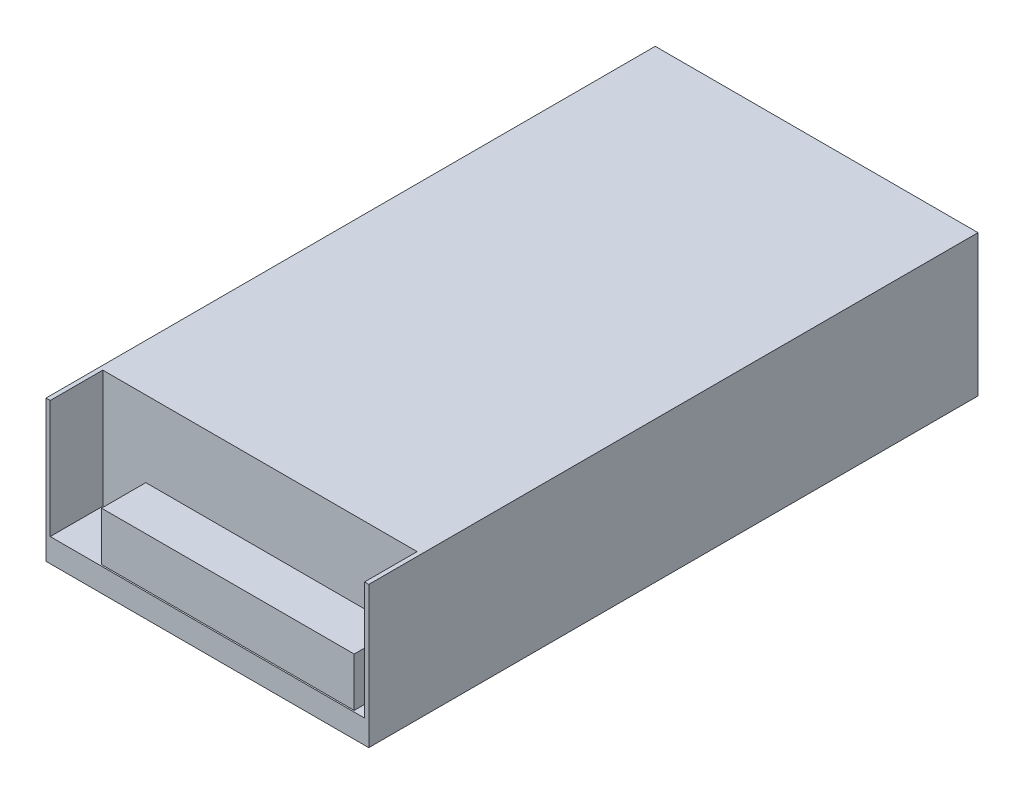
from build123d import *

# Parameters (mm, degrees)
SKETCH1_W           = 113.03
SKETCH1_H           = 213.36
BOSS_EXTRUDE1_DEPTH = 49.53
SKETCH2_W           = 110.0836
SKETCH2_H           = 18.415
CUT_EXTRUDE1_DEPTH  = 41.275
SKETCH3_W           = 88.4682
SKETCH3_H           = 15.494
BOSS_EXTRUDE2_DEPTH = 17.0942
SKETCH4_R           = 1.5875
CUT_EXTRUDE2_DEPTH  = 5


with BuildPart() as part:
    # Sketch1 → Boss-Extrude1 (new body)
    with BuildSketch(Plane(origin=(0, 0, 0), x_dir=(1, 0, 0), z_dir=(0, 1, 0))):
        with Locations((56.515, 106.68)):
            Rectangle(SKETCH1_W, SKETCH1_H)
    extrude(amount=BOSS_EXTRUDE1_DEPTH)

    # Sketch2 → Cut-Extrude1 (cut)
    with BuildSketch(Plane(origin=(0, 49.53, 0), x_dir=(1, 0, 0), z_dir=(0, 1, 0))):
        with Locations((56.515, 9.2075)):
            Rectangle(SKETCH2_W, SKETCH2_H)
    extrude(amount=-CUT_EXTRUDE1_DEPTH, mode=Mode.SUBTRACT)

    # Sketch3 → Boss-Extrude2 (add)
    with BuildSketch(Plane(origin=(0, 8.255, 0), x_dir=(1, 0, 0), z_dir=(0, 1, 0))):
        with Locations((63.1825, 8.255)):
            Rectangle(SKETCH3_W, SKETCH3_H)
    extrude(amount=BOSS_EXTRUDE2_DEPTH)

    # Sketch4 → Cut-Extrude2 (cut)
    with BuildSketch(Plane.XZ):
        with Locations(Location((81.515, -180.86, 0), (0, 0, 270))):
            Circle(SKETCH4_R)
        with Locations(Location((31.515, -180.86, 0), (0, 0, 270))):
            Circle(SKETCH4_R)
        with Locations(Location((81.515, -30.86, 0), (0, 0, 270))):
            Circle(SKETCH4_R)
        with Locations(Location((31.515, -30.86, 0), (0, 0, 270))):
            Circle(SKETCH4_R)
    extrude(amount=-CUT_EXTRUDE2_DEPTH, mode=Mode.SUBTRACT)


solid = part.part
